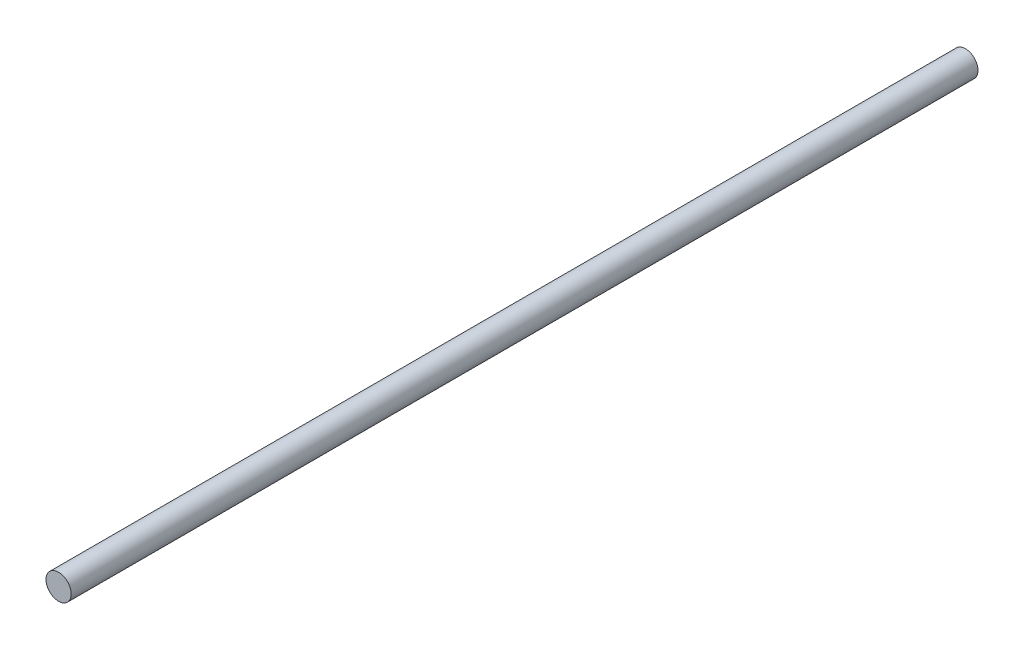
from build123d import *

# Parameters (mm, degrees)
ESQUISSE1_R        = 4
BOSS_EXTRU_1_DEPTH = 288


with BuildPart() as part:
    # Esquisse1 → Boss.-Extru.1 (new body)
    with BuildSketch(Plane.XY):
        Circle(ESQUISSE1_R)
    extrude(amount=BOSS_EXTRU_1_DEPTH)


solid = part.part
